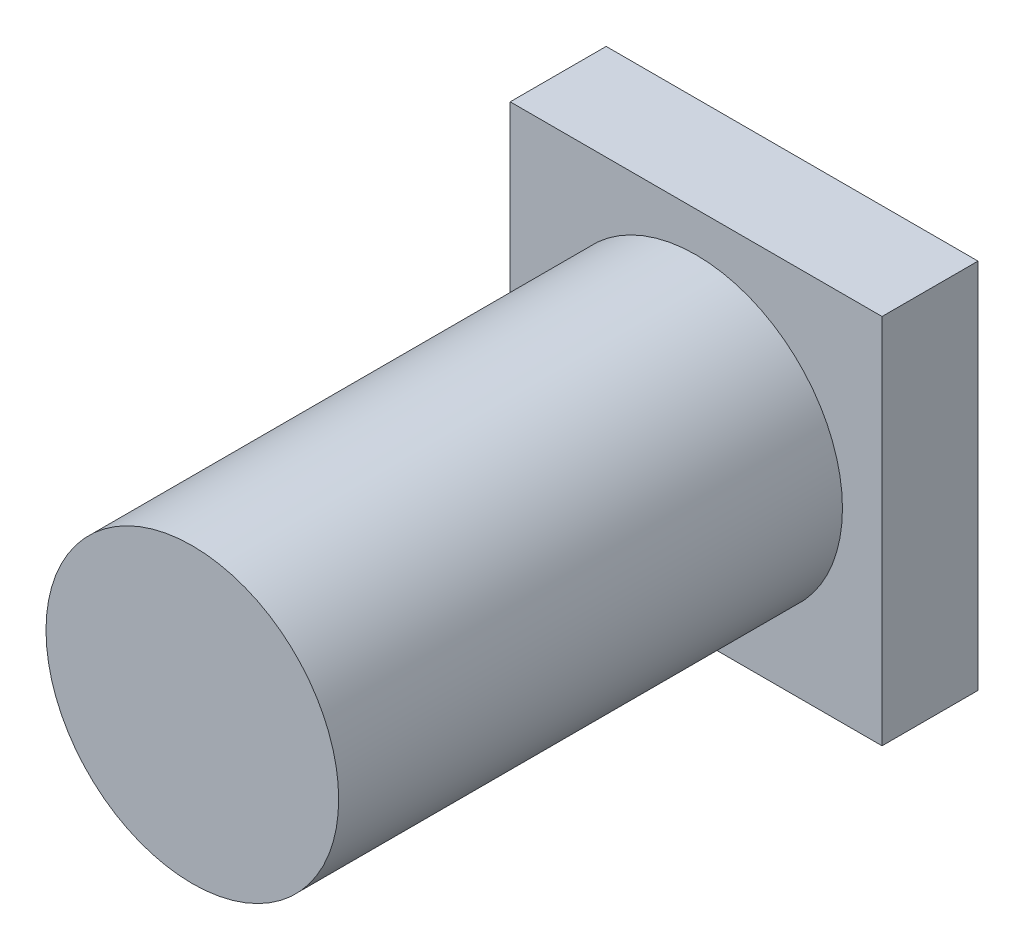
from build123d import *

# Parameters (mm, degrees)
SKETCH1_R           = 6.1
BOSS_EXTRUDE1_DEPTH = 10.5
SKETCH2_W           = 15.5
SKETCH2_H           = 15.5
BOSS_EXTRUDE2_DEPTH = 4
CUT_EXTRUDE1_DEPTH  = 4
SKETCH4_R           = 0.8
CUT_EXTRUDE2_DEPTH  = 5.5


with BuildPart() as part:
    # Sketch1 → Boss-Extrude1 (new, symmetric)
    with BuildSketch(Plane.XY):
        with Locations(Location((0, 0, 0), (0, 0, 180))):
            Circle(SKETCH1_R)
    extrude(amount=BOSS_EXTRUDE1_DEPTH, both=True)

    # Sketch2 → Boss-Extrude2 (add)
    with BuildSketch(Plane(origin=(0, 0, -10.5), x_dir=(-1, 0, 0), z_dir=(0, 0, -1))):
        Rectangle(SKETCH2_W, SKETCH2_H)
    extrude(amount=BOSS_EXTRUDE2_DEPTH)

    # Sketch3 → Cut-Extrude1 (cut)
    with BuildSketch(Plane(origin=(0, 0, -14.5), x_dir=(-1, 0, 0), z_dir=(0, 0, -1))):
        with BuildLine():
            Line((-0.75, 5), (1.25, 5))
            ThreePointArc((1.25, 5), (4.078427125, 3.828427125), (5.25, 1))
            Line((5.25, 1), (5.25, -1))
            ThreePointArc((5.25, -1), (4.078427125, -3.828427125), (1.25, -5))
            Line((1.25, -5), (-0.75, -5))
            Line((-0.75, -5), (-0.75, 5))
        make_face()
    extrude(amount=-CUT_EXTRUDE1_DEPTH, mode=Mode.SUBTRACT)

    # Sketch4 → Cut-Extrude2 (cut)
    with BuildSketch(Plane.ZY.offset(-0.75)):
        with Locations(Location((-12.5, 0, 0), (0, 0, 270))):
            Circle(SKETCH4_R)
    extrude(amount=-CUT_EXTRUDE2_DEPTH, mode=Mode.SUBTRACT)


solid = part.part
